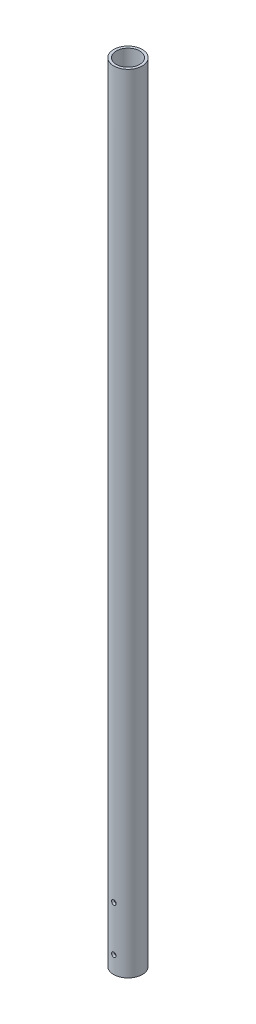
from build123d import *

# Parameters (mm, degrees)
SKETCH1_R               = 21.082
SKETCH1_R_2             = 17.272
BOSS_EXTRUDE1_DEPTH     = 1160.4625
F_1_4_CLEARANCE_HOLE1_D = 6.7564


with BuildPart() as part:
    # Sketch1 → Boss-Extrude1 (new body)
    with BuildSketch(Plane(origin=(0, 0, 0), x_dir=(1, 0, 0), z_dir=(0, 1, 0))):
        with Locations(Location((0, 0, 0), (0, 0, 270))):
            Circle(SKETCH1_R)
        with Locations(Location((0, 0, 0), (0, 0, 270))):
            Circle(SKETCH1_R_2, mode=Mode.SUBTRACT)
    extrude(amount=BOSS_EXTRUDE1_DEPTH)

    # 1/4 Clearance Hole1 (through all)
    with Locations(Plane.XY.offset(21.082)):
        with Locations((0, 25.4), (0, 92.075)):
            Hole(F_1_4_CLEARANCE_HOLE1_D / 2)


solid = part.part
